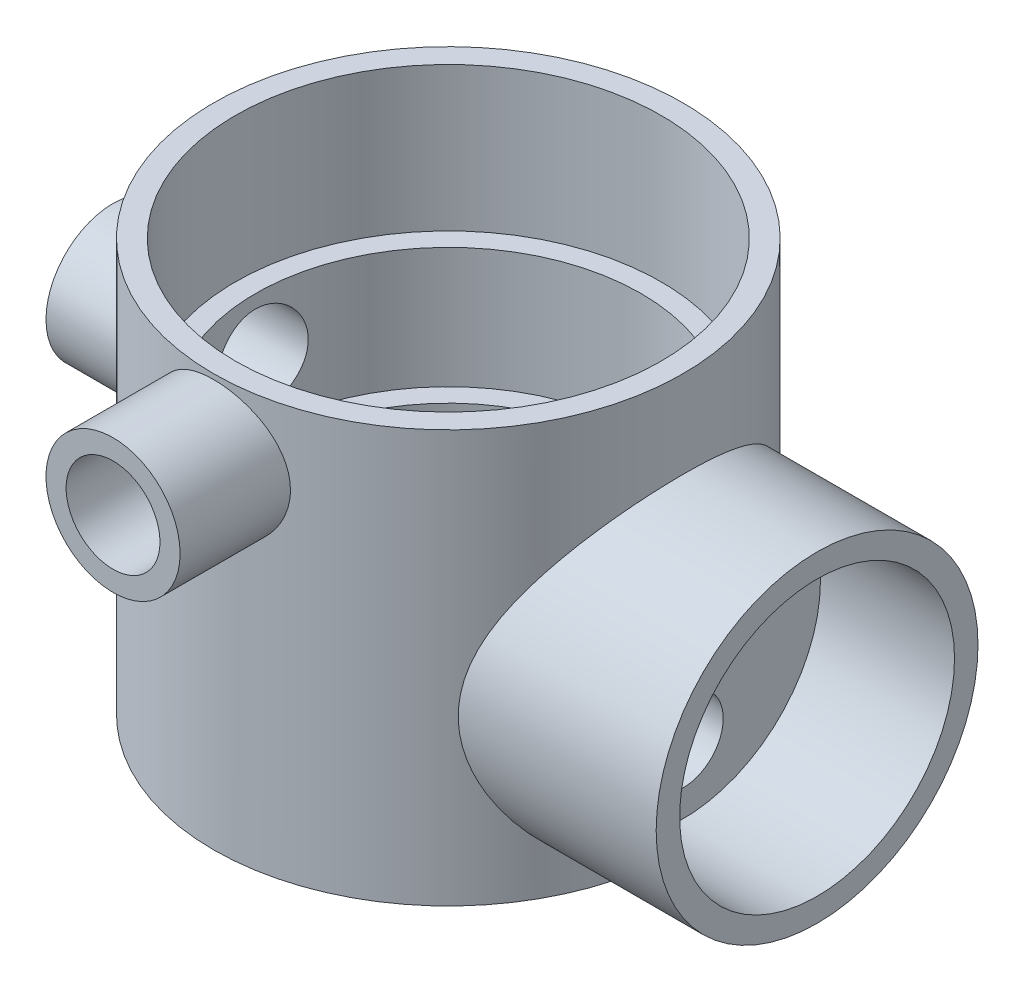
from build123d import *

# Parameters (mm, degrees)
SKETCH1_R                  = 35
BASE_DEPTH                 = 4
SKETCH2_R                  = 7.5
CENTERING_BOSS_DEPTH       = 2
SKETCH3_R                  = 35
SKETCH3_R_2                = 25.75
INLET_TIER_DEPTH           = 18
SKETCH4_R                  = 35
SKETCH4_R_2                = 28.75
PATIENT_TIER_DEPTH         = 18
SKETCH5_R                  = 35
SKETCH5_R_2                = 31.75
OUTLET_TIER_DEPTH          = 21.5
INLET_REACH                = 116.487
INLET_END_RADIUS           = 35
SKETCH7_R                  = 24
SKETCH10_R                 = 20.5
INLET_ID_DEPTH             = 20
INLET_PASS_THRU_REACH      = 101.535
INLET_PASS_THRU_END_RADIUS = 25.75
SKETCH11_R                 = 6
BOSS_EXTRUDE8_REACH        = 128.619
BOSS_EXTRUDE8_END_RADIUS   = 35
SKETCH12_R                 = 10
CUT_EXTRUDE3_REACH         = 128.619
CUT_EXTRUDE3_END_RADIUS    = 28.75
SKETCH13_R                 = 7
BOSS_EXTRUDE9_REACH        = 120.458
BOSS_EXTRUDE9_END_RADIUS   = 35
SKETCH14_R                 = 10
CUT_EXTRUDE4_REACH         = 120.458
CUT_EXTRUDE4_END_RADIUS    = 31.75
SKETCH15_R                 = 7


with BuildPart() as part:
    # Sketch1 → Base (new body)
    with BuildSketch(Plane(origin=(0, 0, 0), x_dir=(1, 0, 0), z_dir=(0, 1, 0))):
        with Locations(Location((0, 0, 0), (0, 0, 270))):
            Circle(SKETCH1_R)
    extrude(amount=BASE_DEPTH)

    # Sketch2 → Centering boss (add)
    with BuildSketch(Plane(origin=(0, 4, 0), x_dir=(1, 0, 0), z_dir=(0, 1, 0))):
        with Locations(Location((0, 0, 0), (0, 0, 270))):
            Circle(SKETCH2_R)
    extrude(amount=CENTERING_BOSS_DEPTH)

    # Sketch3 → Inlet tier (add)
    with BuildSketch(Plane(origin=(0, 4, 0), x_dir=(1, 0, 0), z_dir=(0, 1, 0))):
        with Locations(Location((0, 0, 0), (0, 0, 270))):
            Circle(SKETCH3_R)
        with Locations(Location((0, 0, 0), (0, 0, 270))):
            Circle(SKETCH3_R_2, mode=Mode.SUBTRACT)
    extrude(amount=INLET_TIER_DEPTH)

    # Sketch4 → Patient tier (add)
    with BuildSketch(Plane(origin=(0, 22, 0), x_dir=(1, 0, 0), z_dir=(0, 1, 0))):
        with Locations(Location((0, 0, 0), (0, 0, 270))):
            Circle(SKETCH4_R)
        with Locations(Location((0, 0, 0), (0, 0, 270))):
            Circle(SKETCH4_R_2, mode=Mode.SUBTRACT)
    extrude(amount=PATIENT_TIER_DEPTH)

    # Sketch5 → Outlet tier (add)
    with BuildSketch(Plane(origin=(0, 40, 0), x_dir=(1, 0, 0), z_dir=(0, 1, 0))):
        with Locations(Location((0, 0, 0), (0, 0, 270))):
            Circle(SKETCH5_R)
        with Locations(Location((0, 0, 0), (0, 0, 270))):
            Circle(SKETCH5_R_2, mode=Mode.SUBTRACT)
    extrude(amount=OUTLET_TIER_DEPTH)

    # Inlet: up to this cylinder (the profile starts outside it)
    inlet_end = Plane(origin=(0, 24.5, 0), z_dir=(0, -1, 0)) * Cylinder(INLET_END_RADIUS, 303.974, mode=Mode.PRIVATE)
    # Sketch7 → Inlet (add, up to the surface)
    with BuildSketch(Plane(origin=(55, 0, 0), x_dir=(0, 0, -1), z_dir=(1, 0, 0)), mode=Mode.PRIVATE) as inlet_sk1:
        with Locations((0, 24.5)):
            Circle(SKETCH7_R)
    inlet_tool1 = extrude(inlet_sk1.sketch, amount=-INLET_REACH, mode=Mode.PRIVATE) - inlet_end
    add(inlet_tool1.solids().sort_by_distance((55, 24.5, 0))[0])

    # Sketch10 → Inlet ID (cut)
    with BuildSketch(Plane(origin=(55, 0, 0), x_dir=(0, 0, -1), z_dir=(1, 0, 0))):
        with Locations((0, 24.5)):
            Circle(SKETCH10_R)
    extrude(amount=-INLET_ID_DEPTH, mode=Mode.SUBTRACT)

    # Inlet pass thru: up to this cylinder (the profile starts outside it)
    inlet_pass_thru_end = Plane(origin=(0, 14, 0), z_dir=(0, -1, 0)) * Cylinder(INLET_PASS_THRU_END_RADIUS, 255.57, mode=Mode.PRIVATE)
    # Sketch11 → Inlet pass thru (cut, up to the surface)
    with BuildSketch(Plane(origin=(35, 0, 0), x_dir=(0, 0, -1), z_dir=(1, 0, 0)), mode=Mode.PRIVATE) as inlet_pass_thru_sk1:
        with Locations((0, 14)):
            Circle(SKETCH11_R)
    inlet_pass_thru_tool1 = extrude(inlet_pass_thru_sk1.sketch, amount=-INLET_PASS_THRU_REACH, mode=Mode.PRIVATE) - inlet_pass_thru_end
    add(inlet_pass_thru_tool1.solids().sort_by_distance((35, 14, 0))[0], mode=Mode.SUBTRACT)

    # Boss-Extrude8: up to this cylinder (the profile starts outside it)
    boss_extrude8_end = Plane(origin=(0, 31, 0), z_dir=(0, -1, 0)) * Cylinder(BOSS_EXTRUDE8_END_RADIUS, 328.238, mode=Mode.PRIVATE)
    # Sketch12 → Boss-Extrude8 (add, up to the surface)
    with BuildSketch(Plane(origin=(-50, 0, 0), x_dir=(0, 0, -1), z_dir=(1, 0, 0)), mode=Mode.PRIVATE) as boss_extrude8_sk1:
        with Locations(Location((0, 31, 0), (0, 0, 180))):
            Circle(SKETCH12_R)
    boss_extrude8_tool1 = extrude(boss_extrude8_sk1.sketch, amount=BOSS_EXTRUDE8_REACH, mode=Mode.PRIVATE) - boss_extrude8_end
    add(boss_extrude8_tool1.solids().sort_by_distance((-50, 31, 0))[0])

    # Cut-Extrude3: up to this cylinder (the profile starts outside it)
    cut_extrude3_end = Plane(origin=(0, 31, 0), z_dir=(0, -1, 0)) * Cylinder(CUT_EXTRUDE3_END_RADIUS, 315.738, mode=Mode.PRIVATE)
    # Sketch13 → Cut-Extrude3 (cut, up to the surface)
    with BuildSketch(Plane.ZY.offset(50), mode=Mode.PRIVATE) as cut_extrude3_sk1:
        with Locations((0, 31)):
            Circle(SKETCH13_R)
    cut_extrude3_tool1 = extrude(cut_extrude3_sk1.sketch, amount=-CUT_EXTRUDE3_REACH, mode=Mode.PRIVATE) - cut_extrude3_end
    add(cut_extrude3_tool1.solids().sort_by_distance((-50, 31, 0))[0], mode=Mode.SUBTRACT)

    # Boss-Extrude9: up to this cylinder (the profile starts outside it)
    boss_extrude9_end = Plane(origin=(0, 50.75, 0), z_dir=(0, -1, 0)) * Cylinder(BOSS_EXTRUDE9_END_RADIUS, 311.916, mode=Mode.PRIVATE)
    # Sketch14 → Boss-Extrude9 (add, up to the surface)
    with BuildSketch(Plane.XY.offset(50), mode=Mode.PRIVATE) as boss_extrude9_sk1:
        with Locations((0, 50.75)):
            Circle(SKETCH14_R)
    boss_extrude9_tool1 = extrude(boss_extrude9_sk1.sketch, amount=-BOSS_EXTRUDE9_REACH, mode=Mode.PRIVATE) - boss_extrude9_end
    add(boss_extrude9_tool1.solids().sort_by_distance((0, 50.75, 50))[0])

    # Cut-Extrude4: up to this cylinder (the profile starts outside it)
    cut_extrude4_end = Plane(origin=(0, 50.75, 0), z_dir=(0, -1, 0)) * Cylinder(CUT_EXTRUDE4_END_RADIUS, 305.416, mode=Mode.PRIVATE)
    # Sketch15 → Cut-Extrude4 (cut, up to the surface)
    with BuildSketch(Plane.XY.offset(50), mode=Mode.PRIVATE) as cut_extrude4_sk1:
        with Locations((0, 50.75)):
            Circle(SKETCH15_R)
    cut_extrude4_tool1 = extrude(cut_extrude4_sk1.sketch, amount=-CUT_EXTRUDE4_REACH, mode=Mode.PRIVATE) - cut_extrude4_end
    add(cut_extrude4_tool1.solids().sort_by_distance((0, 50.75, 50))[0], mode=Mode.SUBTRACT)


solid = part.part
